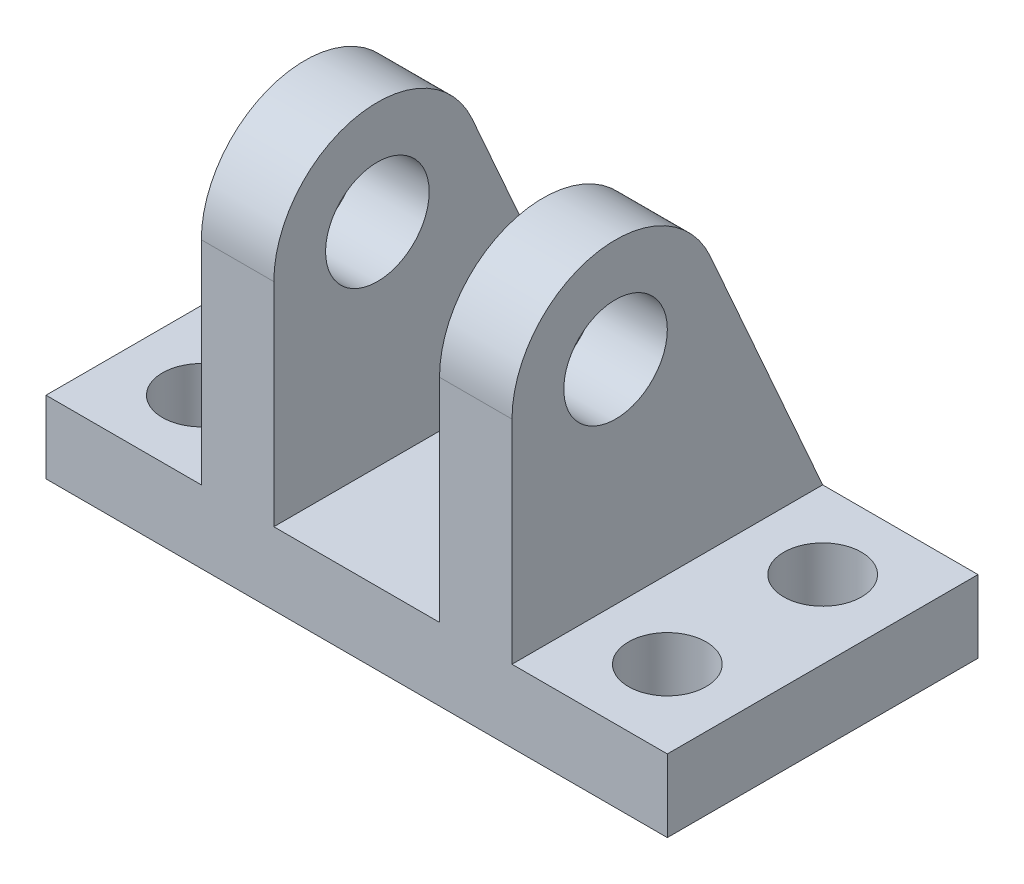
from build123d import *

# Parameters (mm, degrees)
SKETCH_1_W          = 12
SKETCH_1_H          = 12
EXTRUDE_1_DEPTH     = 15
SKETCH_2_W          = 6.4
SKETCH_2_H          = 12.2
CUT_EXTRUDE_1_DEPTH = 12
CUT_EXTRUDE_2_DEPTH = 12
SKETCH_8_R          = 2
CUT_EXTRUDE_3_DEPTH = 21.124611797
SKETCH_10_W         = 6
SKETCH_10_H         = 12
SKETCH_10_R         = 1.5
EXTRUDE_2_DEPTH     = 2.8


with BuildPart() as part:
    # 草图1 → 凸台-拉伸1 (new body)
    with BuildSketch(Plane(origin=(0, 0, 0), x_dir=(1, 0, 0), z_dir=(0, 1, 0))):
        Rectangle(SKETCH_1_W, SKETCH_1_H)
    extrude(amount=EXTRUDE_1_DEPTH)

    # 草图2 → 切除-拉伸1 (cut)
    with BuildSketch(Plane.XY.offset(6)):
        with Locations((0, 8.9)):
            Rectangle(SKETCH_2_W, SKETCH_2_H)
    extrude(amount=-CUT_EXTRUDE_1_DEPTH, mode=Mode.SUBTRACT)

    # 草图3 → 切除-拉伸2 (cut)
    with BuildSketch(Plane.ZY.offset(6)):
        with BuildLine():
            Line((-6, 15), (-6, 2.8))
            Line((-6, 2.8), (-1.658241819, 12.617796896))
            ThreePointArc((-1.658241819, 12.617796896), (-0.18275198, 14.351953728), (2, 15))
            Line((2, 15), (-6, 15))
        make_face()
        with BuildLine():
            ThreePointArc((2, 15), (4.828427125, 13.828427125), (6, 11))
            Line((6, 11), (6, 15))
            Line((6, 15), (2, 15))
        make_face()
    extrude(amount=-CUT_EXTRUDE_2_DEPTH, mode=Mode.SUBTRACT)

    # 草图8 → 切除-拉伸3 (cut, through all)
    with BuildSketch(Plane(origin=(6, 0, 0), x_dir=(0, 0, -1), z_dir=(1, 0, 0))):
        with Locations((-2, 11)):
            Circle(SKETCH_8_R)
    extrude(amount=-CUT_EXTRUDE_3_DEPTH, mode=Mode.SUBTRACT)

    # 草图10 → 凸台-拉伸2 (add)
    # profile 1 of 2: a face of its own
    with BuildSketch(Plane(origin=(0, 0, 0), x_dir=(1, 0, 0), z_dir=(0, 1, 0))):
        with Locations((-9, 0)):
            Rectangle(SKETCH_10_W, SKETCH_10_H)
        with Locations(Location((-9, 3, 0), (0, 0, 90))):
            Circle(SKETCH_10_R, mode=Mode.SUBTRACT)
        with Locations(Location((-9, -3, 0), (0, 0, 90))):
            Circle(SKETCH_10_R, mode=Mode.SUBTRACT)
    # profile 2 of 2: a face of its own
    with BuildSketch(Plane(origin=(0, 0, 0), x_dir=(1, 0, 0), z_dir=(0, 1, 0))):
        with Locations((9, 0)):
            Rectangle(SKETCH_10_W, SKETCH_10_H)
        with Locations(Location((9, 3, 0), (0, 0, 90))):
            Circle(SKETCH_10_R, mode=Mode.SUBTRACT)
        with Locations(Location((9, -3, 0), (0, 0, 90))):
            Circle(SKETCH_10_R, mode=Mode.SUBTRACT)
    extrude(amount=EXTRUDE_2_DEPTH)


solid = part.part
